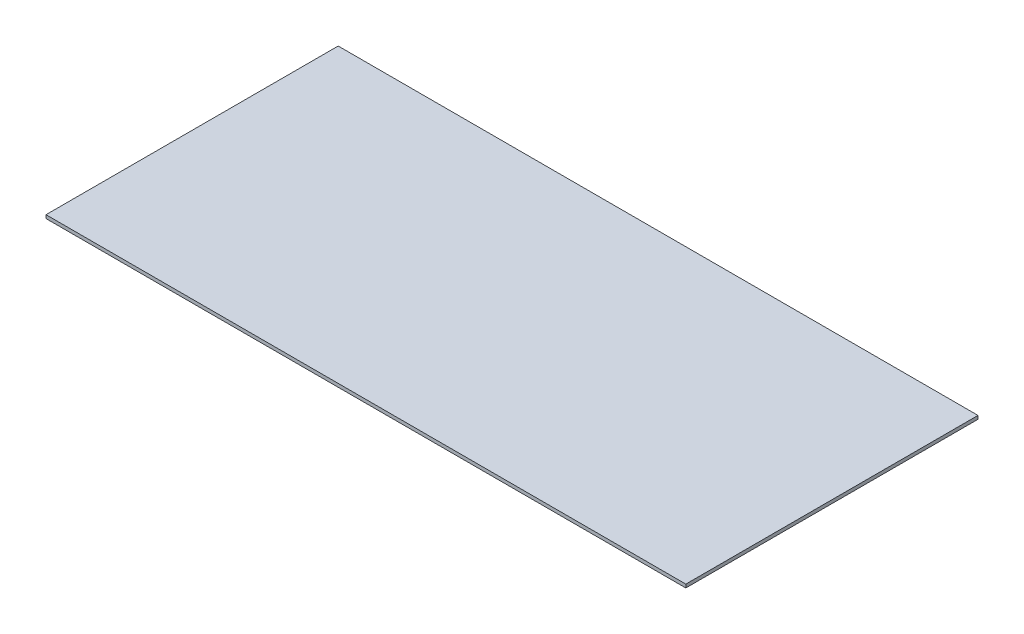
from build123d import *

# Parameters (mm, degrees)
SKETCH2_W           = 946
SKETCH2_H           = 432
BOSS_EXTRUDE1_DEPTH = 5


with BuildPart() as part:
    # Sketch2 → Boss-Extrude1 (new body)
    with BuildSketch(Plane(origin=(0, 0, 0), x_dir=(1, 0, 0), z_dir=(0, 1, 0))):
        with Locations((-9482.523809524, 3950.904761905)):
            Rectangle(SKETCH2_W, SKETCH2_H)
    extrude(amount=BOSS_EXTRUDE1_DEPTH)


solid = part.part
